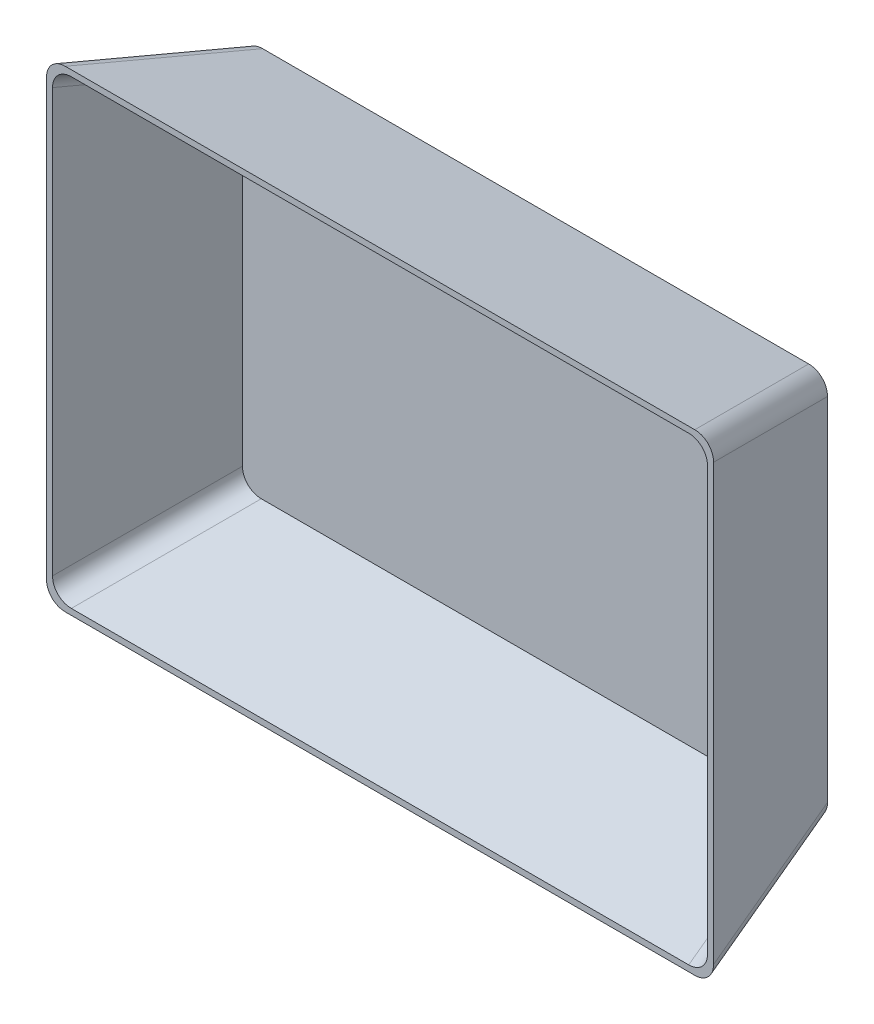
from build123d import *

# Parameters (mm, degrees)
SKETCH_1_W      = 300
SKETCH_1_H      = 200
EXTRUDE_1_DEPTH = 80
EXTRUDE_1_DRAFT = -15
SHELL_1_T       = -3
FILLET_1_R      = 10


with BuildPart() as part:
    # 草图1 → 凸台-拉伸1 (with draft: the straight prism first)
    with BuildSketch(Plane.XY):
        Rectangle(SKETCH_1_W, SKETCH_1_H)
    extrude(amount=EXTRUDE_1_DEPTH)
    # 凸台-拉伸1: the draft: its side faces are tilted about the plane it starts from
    extrude_1_sides = [part.faces().sort_by_distance(p)[0] for p in [
        (0, -100, 40),
        (150, 0, 40),
        (0, 100, 40),
        (-150, 0, 40),
    ]]
    draft(extrude_1_sides, Plane.XY, EXTRUDE_1_DRAFT)

    # 抽壳1
    shell_1_openings = [part.faces().sort_by_distance(p)[0] for p in [
        (0, 0, 80),
    ]]
    offset(amount=SHELL_1_T, openings=shell_1_openings, kind=Kind.INTERSECTION)

    # 圆角1
    fillet_1_edges = [part.edges().sort_by_distance(p)[0] for p in [
        (158.014062945, -108.014062945, 41.5),
        (158.014062945, 108.014062945, 41.5),
        (-158.014062945, 108.014062945, 41.5),
        (-158.014062945, -108.014062945, 41.5),
        (160.717967697, -110.717967697, 40),
        (-160.717967697, -110.717967697, 40),
        (-160.717967697, 110.717967697, 40),
        (160.717967697, 110.717967697, 40),
    ]]
    fillet(fillet_1_edges, radius=FILLET_1_R)


solid = part.part
